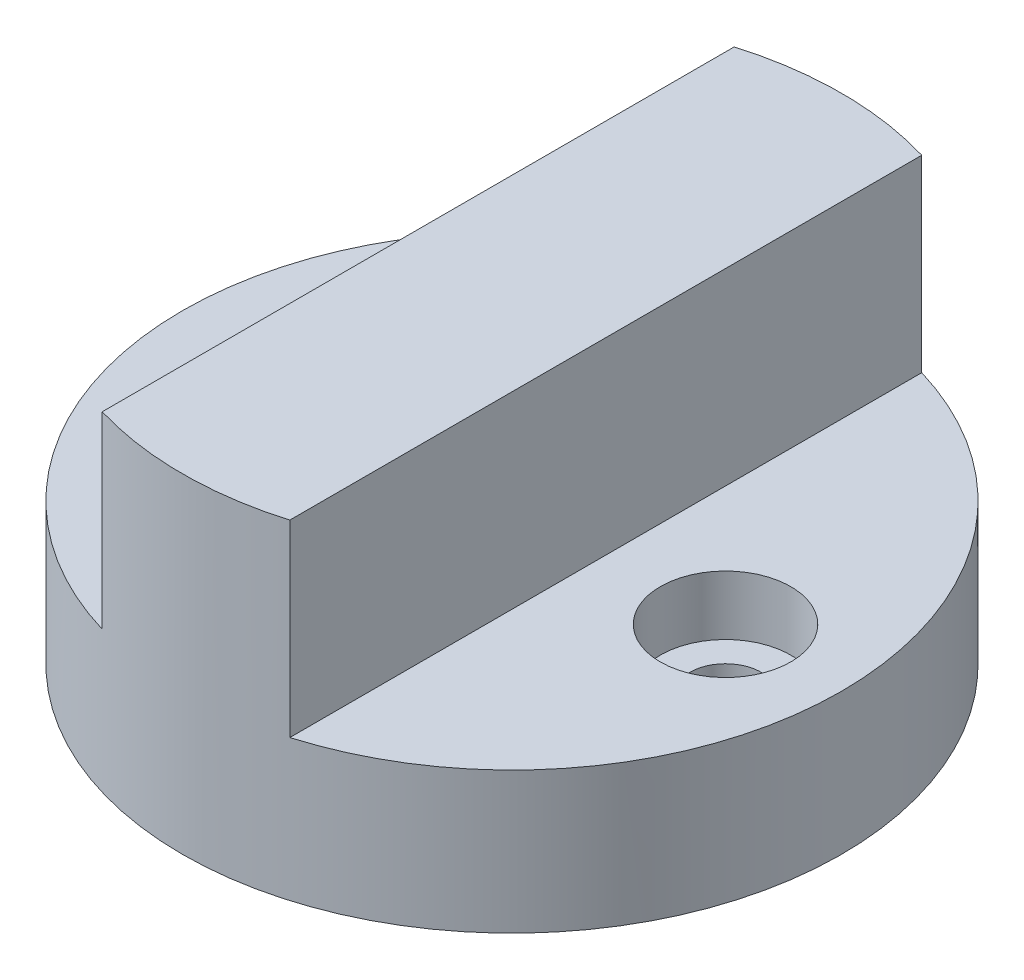
from build123d import *

# Parameters (mm, degrees)
SKETCH1_R                      = 11.1125
BOSS_EXTRUDE1_DEPTH            = 11.1125
CUT_EXTRUDE1_START             = -6.35
CUT_EXTRUDE1_DEPTH             = 6.35
CBORE_FOR_M2_SHCS1_D           = 2.4
CBORE_FOR_M2_SHCS1_CBORE_D     = 4.4
CBORE_FOR_M2_SHCS1_CBORE_DEPTH = 2


with BuildPart() as part:
    # Sketch1 → Boss-Extrude1 (new body)
    with BuildSketch(Plane(origin=(0, 0, 0), x_dir=(1, 0, 0), z_dir=(0, 1, 0))):
        with Locations(Location((0, 0, 0), (0, 0, 270))):
            Circle(SKETCH1_R)
    extrude(amount=BOSS_EXTRUDE1_DEPTH)

    # Sketch2 → Cut-Extrude1 (cut)
    with BuildSketch(Plane(origin=(0, 11.1125, 0), x_dir=(1, 0, 0), z_dir=(0, 1, 0)).offset(CUT_EXTRUDE1_START)):
        with BuildLine():
            Line((-3.1623, 10.653051908), (-3.1623, -10.653051908))
            ThreePointArc((-3.1623, -10.653051908), (-11.1125, 0), (-3.1623, 10.653051908))
        make_face()
        with BuildLine():
            Line((3.1623, 10.653051908), (3.1623, -10.653051908))
            ThreePointArc((3.1623, -10.653051908), (11.1125, 0), (3.1623, 10.653051908))
        make_face()
    extrude(amount=CUT_EXTRUDE1_DEPTH, mode=Mode.SUBTRACT)

    # CBORE for M2 SHCS1 (through all)
    with Locations(Plane(origin=(0, 4.7625, 0), x_dir=(1, 0, 0), z_dir=(0, 1, 0))):
        with Locations((-7.2, 0), (7.2, 0)):
            CounterBoreHole(CBORE_FOR_M2_SHCS1_D / 2, CBORE_FOR_M2_SHCS1_CBORE_D / 2, CBORE_FOR_M2_SHCS1_CBORE_DEPTH)


solid = part.part
